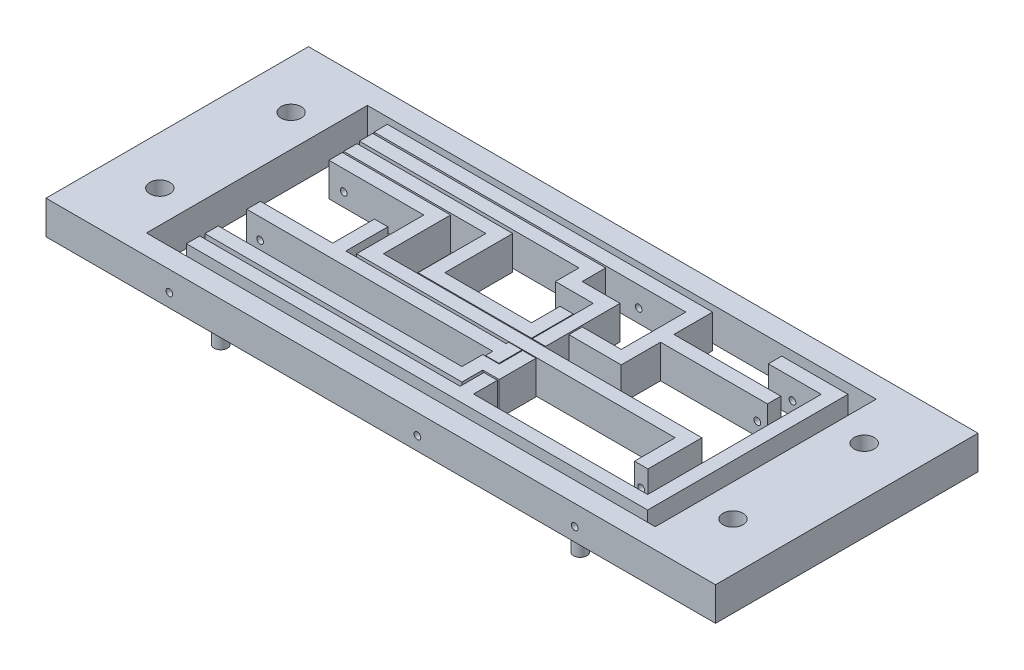
from build123d import *

# Parameters (mm, degrees)
SKETCH2_W               = 127
SKETCH2_H               = 49.784
SKETCH2_R               = 1.905
BOSS_EXTRUDE1_DEPTH     = 6.35
SKETCH6_W               = 96.52
SKETCH6_H               = 41.91
CUT_EXTRUDE4_DEPTH      = 6.35
BOSS_EXTRUDE2_DEPTH     = 6.35
BOSS_EXTRUDE2_2_DEPTH   = 6.35
BOSS_EXTRUDE2_3_DEPTH   = 6.35
BOSS_EXTRUDE2_4_DEPTH   = 6.35
BOSS_EXTRUDE2_5_DEPTH   = 6.35
BOSS_EXTRUDE2_6_DEPTH   = 6.35
BOSS_EXTRUDE2_7_DEPTH   = 6.35
CUT_EXTRUDE5_DEPTH      = 25.4
CUT_EXTRUDE5_DEPTH_BACK = 50.8
SKETCH15_R              = 0.635
CUT_EXTRUDE6_DEPTH      = 50.8
CUT_EXTRUDE6_DEPTH_BACK = 50.8
SKETCH16_R              = 0.635
CUT_EXTRUDE7_DEPTH      = 50.8
CUT_EXTRUDE7_DEPTH_BACK = 50.8
SKETCH17_R              = 0.635
SKETCH18_R              = 1.27
BOSS_EXTRUDE3_DEPTH     = 3


with BuildPart() as part:
    # Sketch2 → Boss-Extrude1 (new body)
    with BuildSketch(Plane(origin=(0, 0, 0), x_dir=(1, 0, 0), z_dir=(0, 1, 0))):
        Rectangle(SKETCH2_W, SKETCH2_H)
        with Locations(Location((-54.356, 12.446, 0), (0, 0, 270))):
            Circle(SKETCH2_R, mode=Mode.SUBTRACT)
        with Locations(Location((-54.356, -12.446, 0), (0, 0, 270))):
            Circle(SKETCH2_R, mode=Mode.SUBTRACT)
        with Locations(Location((54.356, -12.446, 0), (0, 0, 270))):
            Circle(SKETCH2_R, mode=Mode.SUBTRACT)
        with Locations(Location((54.356, 12.446, 0), (0, 0, 270))):
            Circle(SKETCH2_R, mode=Mode.SUBTRACT)
    extrude(amount=BOSS_EXTRUDE1_DEPTH)

    # Sketch6 → Cut-Extrude4 (cut)
    with BuildSketch(Plane(origin=(0, 0, 0), x_dir=(1, 0, 0), z_dir=(0, 1, 0))):
        with Locations((0, -0.127)):
            Rectangle(SKETCH6_W, SKETCH6_H)
    extrude(amount=CUT_EXTRUDE4_DEPTH, mode=Mode.SUBTRACT)


with BuildPart() as body_2:
    # Sketch3 → Boss-Extrude2 (new body)
    with BuildSketch(Plane(origin=(0, 0, 0), x_dir=(1, 0, 0), z_dir=(0, 1, 0))):
        Polygon((6.154854934, -15.651814381), (6.154854934, -11.701067552), (9.269592965, -11.701067552), (9.269592965, -4.714961554), (6.729592965, -4.714961554), (6.729592965, -9.161067552), (3.614854934, -9.161067552), (3.614854934, -13.111814381), (-42.607221298, -13.111814381), (-42.607221298, -15.651814381), align=None)
    extrude(amount=BOSS_EXTRUDE2_DEPTH)


with BuildPart() as body_3:
    # Sketch3 → Boss-Extrude2 2 (new body)
    with BuildSketch(Plane(origin=(0, 0, 0), x_dir=(1, 0, 0), z_dir=(0, 1, 0))):
        Polygon((6.681811508, -19.056068665), (44.784257715, -19.056068665), (44.784257715, 18.947165967), (32.217316, 18.947165967), (32.217316, 16.407165967), (42.244257715, 16.407165967), (42.244257715, -16.516068665), (9.221811508, -16.516068665), (9.221811508, -12.004972739), (6.681811508, -12.004972739), (6.681811508, -16.516068665), (-42.707308803, -16.516068665), (-42.707308803, -19.056068665), align=None)
    extrude(amount=BOSS_EXTRUDE2_2_DEPTH)


with BuildPart() as body_4:
    # Sketch3 → Boss-Extrude2 3 (new body)
    with BuildSketch(Plane(origin=(0, 0, 0), x_dir=(1, 0, 0), z_dir=(0, 1, 0))):
        Polygon((4.034812993, -9.058698302), (6.574812993, -9.058698302), (6.574812993, -4.665316578), (4.034812993, -4.665316578), (4.034812993, -5.139108905), (-26.379252172, -5.139108905), (-26.379252172, -2.011098606), (-26.379252172, 2.82812497), (-28.919252172, 2.82812497), (-28.919252172, -5.076322676), (-42.638026623, -5.076322676), (-42.638026623, -7.679108905), (4.034812993, -7.679108905), align=None)
    extrude(amount=BOSS_EXTRUDE2_3_DEPTH)


with BuildPart() as body_5:
    # Sketch3 → Boss-Extrude2 4 (new body)
    with BuildSketch(Plane(origin=(0, 0, 0), x_dir=(1, 0, 0), z_dir=(0, 1, 0))):
        Polygon((38.062713566, -12.286208758), (35.522713566, -12.286208758), (35.522713566, -4.579152905), (-24.903759225, -4.562203694), (-24.903759225, 8.172663229), (-37.854300977, 8.172663229), (-42.906324163, 8.172663229), (-42.906324163, 10.712663229), (-22.363759225, 10.712663229), (-22.363759225, -2.022916046), (38.062713566, -2.039865257), align=None)
    extrude(amount=BOSS_EXTRUDE2_4_DEPTH)


with BuildPart() as body_6:
    # Sketch3 → Boss-Extrude2 5 (new body)
    with BuildSketch(Plane(origin=(0, 0, 0), x_dir=(1, 0, 0), z_dir=(0, 1, 0))):
        Polygon((-42.964078943, 11.023833678), (-42.964078943, 13.563833678), (-13.434161448, 13.563833678), (-13.434161448, 0.692636058), (3.013297456, 0.692636058), (3.013297456, 6.096432161), (5.553297456, 6.096432161), (5.553297456, -1.847363942), (-15.974161448, -1.847363942), (-15.974161448, 11.023833678), align=None)
    extrude(amount=BOSS_EXTRUDE2_5_DEPTH)


with BuildPart() as body_7:
    # Sketch3 → Boss-Extrude2 6 (new body)
    with BuildSketch(Plane(origin=(0, 0, 0), x_dir=(1, 0, 0), z_dir=(0, 1, 0))):
        Polygon((15.896804082, 2.279758279), (8.50716707, 2.279758279), (8.50716707, 4.819758279), (15.896804082, 4.819758279), (15.896804082, 17.075678804), (-4.989775823, 17.075678804), (-43.258408751, 17.075678804), (-43.258408751, 19.615678804), (2.402153274, 19.615678804), (18.436804082, 19.615678804), (18.436804082, 12.273203088), (38.715415512, 12.273203088), (38.715415512, 9.733203088), (18.436804082, 9.733203088), (18.436804082, 2.279758279), align=None)
    extrude(amount=BOSS_EXTRUDE2_6_DEPTH)


with BuildPart() as body_8:
    # Sketch3 → Boss-Extrude2 7 (new body)
    with BuildSketch(Plane(origin=(0, 0, 0), x_dir=(1, 0, 0), z_dir=(0, 1, 0))):
        Polygon((-43.153809952, 16.735514713), (-43.153809952, 14.195514713), (-11.01999016, 14.195514713), (-1.496582765, 14.195514713), (-1.496582765, 9.729573122), (5.682084936, 9.729573122), (5.682084936, 1.258739409), (5.695914501, 1.258739409), (5.695914501, -1.847763753), (8.235914501, -1.847763753), (8.235914501, 3.798739409), (8.222084936, 3.798739409), (8.222084936, 12.269573122), (1.043417235, 12.269573122), (1.043417235, 16.735514713), align=None)
    extrude(amount=BOSS_EXTRUDE2_7_DEPTH)


with BuildPart() as cut_extrude5_tool:
    # Sketch15 → Cut-Extrude5 (new, two sides: drawn at the far end of the back side and taken through both)
    with BuildSketch(Plane.XY.offset(7.679108905).offset(-CUT_EXTRUDE5_DEPTH_BACK)):
        with Locations(Location((-40.098026623, 2.54, 0), (0, 0, 180))):
            Circle(SKETCH15_R)
    extrude(amount=CUT_EXTRUDE5_DEPTH + CUT_EXTRUDE5_DEPTH_BACK)


with BuildPart() as part_1:
    add(part.part)

    # Cut-Extrude5: cut by cut_extrude5_tool
    add(cut_extrude5_tool.part, mode=Mode.SUBTRACT)


with BuildPart() as body_2_1:
    add(body_2.part)

    # Cut-Extrude5: cut by cut_extrude5_tool
    add(cut_extrude5_tool.part, mode=Mode.SUBTRACT)


with BuildPart() as body_3_1:
    add(body_3.part)

    # Cut-Extrude5: cut by cut_extrude5_tool
    add(cut_extrude5_tool.part, mode=Mode.SUBTRACT)


with BuildPart() as body_4_1:
    add(body_4.part)

    # Cut-Extrude5: cut by cut_extrude5_tool
    add(cut_extrude5_tool.part, mode=Mode.SUBTRACT)


with BuildPart() as body_5_1:
    add(body_5.part)

    # Cut-Extrude5: cut by cut_extrude5_tool
    add(cut_extrude5_tool.part, mode=Mode.SUBTRACT)


with BuildPart() as body_6_1:
    add(body_6.part)

    # Cut-Extrude5: cut by cut_extrude5_tool
    add(cut_extrude5_tool.part, mode=Mode.SUBTRACT)


with BuildPart() as body_7_1:
    add(body_7.part)

    # Cut-Extrude5: cut by cut_extrude5_tool
    add(cut_extrude5_tool.part, mode=Mode.SUBTRACT)


with BuildPart() as body_8_1:
    add(body_8.part)

    # Cut-Extrude5: cut by cut_extrude5_tool
    add(cut_extrude5_tool.part, mode=Mode.SUBTRACT)


with BuildPart() as cut_extrude6_tool:
    # Sketch16 → Cut-Extrude6 (new, two sides: drawn at the far end of the back side and taken through both)
    with BuildSketch(Plane(origin=(0, 0, -12.269573122), x_dir=(-1, 0, 0), z_dir=(0, 0, -1)).offset(-CUT_EXTRUDE6_DEPTH_BACK)):
        with Locations(Location((-6.952084936, 2.54, 0), (0, 0, 180))):
            Circle(SKETCH16_R)
    extrude(amount=CUT_EXTRUDE6_DEPTH + CUT_EXTRUDE6_DEPTH_BACK)


with BuildPart() as part_2:
    add(part_1.part)

    # Cut-Extrude6: cut by cut_extrude6_tool
    add(cut_extrude6_tool.part, mode=Mode.SUBTRACT)


with BuildPart() as body_2_2:
    add(body_2_1.part)

    # Cut-Extrude6: cut by cut_extrude6_tool
    add(cut_extrude6_tool.part, mode=Mode.SUBTRACT)


with BuildPart() as body_3_2:
    add(body_3_1.part)

    # Cut-Extrude6: cut by cut_extrude6_tool
    add(cut_extrude6_tool.part, mode=Mode.SUBTRACT)


with BuildPart() as body_4_2:
    add(body_4_1.part)

    # Cut-Extrude6: cut by cut_extrude6_tool
    add(cut_extrude6_tool.part, mode=Mode.SUBTRACT)


with BuildPart() as body_5_2:
    add(body_5_1.part)

    # Cut-Extrude6: cut by cut_extrude6_tool
    add(cut_extrude6_tool.part, mode=Mode.SUBTRACT)


with BuildPart() as body_7_2:
    add(body_7_1.part)

    # Cut-Extrude6: cut by cut_extrude6_tool
    add(cut_extrude6_tool.part, mode=Mode.SUBTRACT)


with BuildPart() as body_8_2:
    add(body_8_1.part)

    # Cut-Extrude6: cut by cut_extrude6_tool
    add(cut_extrude6_tool.part, mode=Mode.SUBTRACT)


with BuildPart() as cut_extrude7_tool:
    # Sketch17 → Cut-Extrude7 (new, two sides: drawn at the far end of the back side and taken through both)
    with BuildSketch(Plane(origin=(-0.000569174, 0, 2.029188768), x_dir=(-0.9999999606618017, 0, -0.0002804931282683121), z_dir=(0.00028049312826831214, 0, -0.9999999606618017)).offset(-CUT_EXTRUDE7_DEPTH_BACK)):
        with Locations((-36.793284237, 2.54)):
            Circle(SKETCH17_R)
    extrude(amount=CUT_EXTRUDE7_DEPTH + CUT_EXTRUDE7_DEPTH_BACK)


with BuildPart() as part_3:
    add(part_2.part)

    # Cut-Extrude7: cut by cut_extrude7_tool
    add(cut_extrude7_tool.part, mode=Mode.SUBTRACT)

    # Sketch18 → Boss-Extrude3 (add)
    with BuildSketch(Plane.XZ):
        with Locations(Location((-32.250797371, 22.987, 0), (0, 0, 270))):
            Circle(SKETCH18_R)
        with Locations(Location((35.933918828, 22.987, 0), (0, 0, 270))):
            Circle(SKETCH18_R)
        with Locations(Location((-32.250797371, -22.733, 0), (0, 0, 270))):
            Circle(SKETCH18_R)
        with Locations(Location((35.933918828, -22.733, 0), (0, 0, 270))):
            Circle(SKETCH18_R)
    extrude(amount=BOSS_EXTRUDE3_DEPTH)


with BuildPart() as body_3_3:
    add(body_3_2.part)

    # Cut-Extrude7: cut by cut_extrude7_tool
    add(cut_extrude7_tool.part, mode=Mode.SUBTRACT)


with BuildPart() as body_5_3:
    add(body_5_2.part)

    # Cut-Extrude7: cut by cut_extrude7_tool
    add(cut_extrude7_tool.part, mode=Mode.SUBTRACT)


with BuildPart() as body_7_3:
    add(body_7_2.part)

    # Cut-Extrude7: cut by cut_extrude7_tool
    add(cut_extrude7_tool.part, mode=Mode.SUBTRACT)


solid = Compound([body_6_1.part, body_2_2.part, body_4_2.part, body_8_2.part, part_3.part, body_3_3.part, body_5_3.part, body_7_3.part])
